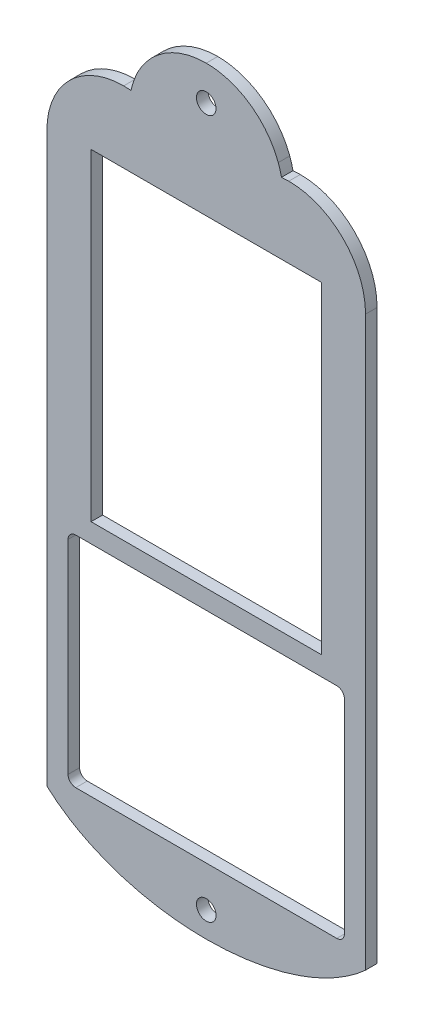
from build123d import *

# Parameters (mm, degrees)
SKETCH_1_R      = 2.55
SKETCH_1_W      = 60
SKETCH_1_H      = 84
EXTRUDE_1_DEPTH = 3


with BuildPart() as part:
    # 草图1 → 凸台-拉伸1 (new body)
    with BuildSketch(Plane.XY):
        with BuildLine():
            Line((-84.749966119, 68.150894314), (-84.749966119, -79.849105686))
            add(Edge.make_bspline(
                [(-84.749966119, -79.849105686), (-81.638463536, -82.692493713), (-77.817874174, -85.197228854), (-73.446952341, -87.268032686)],
                knots=[11, 11, 11, 11, 12, 12, 12, 12], degree=3))
            add(Edge.make_bspline(
                [(-73.446952341, -87.268032686), (-65.029679733, -91.257948491), (-54.573341235, -93.618032685), (-43.249183184, -93.618032685)],
                knots=[12, 12, 12, 12, 13, 13, 13, 13], degree=3))
            add(Edge.make_bspline(
                [(-43.249183184, -93.618032685), (-31.925025133, -93.618032685), (-21.468686634, -91.257948491), (-13.051414026, -87.268032686)],
                knots=[13, 13, 13, 13, 14, 14, 14, 14], degree=3))
            add(Edge.make_bspline(
                [(-13.051414026, -87.268032686), (-8.680492193, -85.197228854), (-4.859902832, -82.692493713), (-1.748400249, -79.849105686)],
                knots=[14, 14, 14, 14, 15, 15, 15, 15], degree=3))
            Line((-1.748400249, -79.849105686), (-1.748400249, 68.150894314))
            add(Edge.make_bspline(
                [(-1.748400249, 68.150894314), (-1.748400249, 79.196365672), (-10.701901969, 88.149867392), (-21.747373327, 88.149867392)],
                knots=[0, 0, 0, 0, 1, 1, 1, 1], degree=3))
            add(Edge.make_bspline(
                [(-21.747373327, 88.149867392), (-22.389431466, 88.149867392), (-23.027958383, 88.11812945), (-23.655913162, 88.058141725)],
                knots=[1, 1, 1, 1, 2, 2, 2, 2], degree=3))
            add(Edge.make_bspline(
                [(-23.655913162, 88.058141725), (-23.86050877, 89.056508865), (-24.142748218, 90.030178976), (-24.48846355, 90.972089614)],
                knots=[2, 2, 2, 2, 3, 3, 3, 3], degree=3))
            add(Edge.make_bspline(
                [(-24.48846355, 90.972089614), (-27.310685771, 98.592102531), (-34.644928018, 104.024867388), (-43.249183184, 104.024867388)],
                knots=[3, 3, 3, 3, 4, 4, 4, 4], degree=3))
            add(Edge.make_bspline(
                [(-43.249183184, 104.024867388), (-51.853438349, 104.024867388), (-59.187680596, 98.592102531), (-62.009902817, 90.972089614)],
                knots=[4, 4, 4, 4, 5, 5, 5, 5], degree=3))
            add(Edge.make_bspline(
                [(-62.009902817, 90.972089614), (-62.355639681, 90.030178976), (-62.637857597, 89.056508865), (-62.842453205, 88.058141725)],
                knots=[5, 5, 5, 5, 6, 6, 6, 6], degree=3))
            add(Edge.make_bspline(
                [(-62.842453205, 88.058141725), (-63.470407985, 88.11812945), (-64.105403678, 88.149867392), (-64.747461817, 88.149867392)],
                knots=[6, 6, 6, 6, 7, 7, 7, 7], degree=3))
            add(Edge.make_bspline(
                [(-64.747461817, 88.149867392), (-75.796464398, 88.149867392), (-84.749966119, 79.196365672), (-84.749966119, 68.150894314)],
                knots=[7, 7, 7, 7, 8, 8, 8, 8], degree=3))
        make_face()
        with Locations((-43.249183184, 95.010103095)):
            Circle(SKETCH_1_R, mode=Mode.SUBTRACT)
        with Locations((-43.249183184, -86.989896905)):
            Circle(SKETCH_1_R, mode=Mode.SUBTRACT)
        with Locations((-43.249183184, 27.571859125)):
            Rectangle(SKETCH_1_W, SKETCH_1_H, mode=Mode.SUBTRACT)
        with BuildLine():
            Line((-77.249183184, -19.428140875), (-9.249183184, -19.428140875))
            ThreePointArc((-9.249183184, -19.428140875), (-7.834969621, -20.013927313), (-7.249183184, -21.428140875))
            Line((-7.249183184, -21.428140875), (-7.249183184, -74.428140875))
            ThreePointArc((-7.249183184, -74.428140875), (-7.834969621, -75.842354437), (-9.249183184, -76.428140875))
            Line((-9.249183184, -76.428140875), (-77.249183184, -76.428140875))
            ThreePointArc((-77.249183184, -76.428140875), (-78.663396746, -75.842354437), (-79.249183184, -74.428140875))
            Line((-79.249183184, -74.428140875), (-79.249183184, -21.428140875))
            ThreePointArc((-79.249183184, -21.428140875), (-78.663396746, -20.013927313), (-77.249183184, -19.428140875))
        make_face(mode=Mode.SUBTRACT)
    extrude(amount=EXTRUDE_1_DEPTH)


solid = part.part
